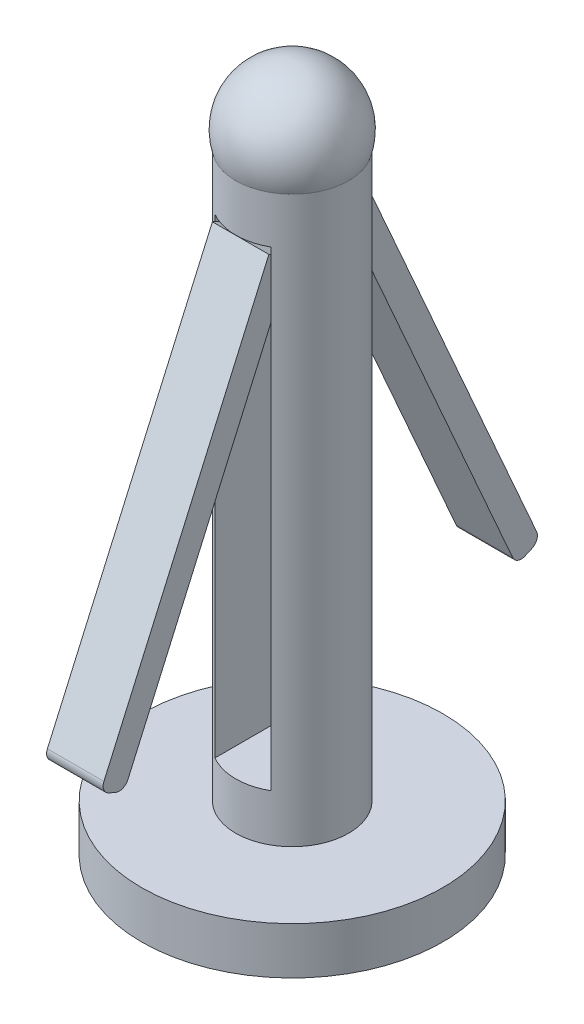
from build123d import *

# Parameters (mm, degrees)
SKETCH1_R               = 16
BOSS_EXTRUDE1_DEPTH     = 5
SKETCH2_R               = 6
BOSS_EXTRUDE2_DEPTH     = 60
DOME1_FACE_RADIUS       = 6
DOME1_HEIGHT            = 8
CUT_EXTRUDE1_DEPTH      = 6
CUT_EXTRUDE1_DEPTH_BACK = 6
SKETCH3_W               = 6
SKETCH3_H               = 50
BOSS_EXTRUDE6_DEPTH     = 6
FILLET2_R               = 1
FILLET4_R               = 1
FILLET2_OF_MIRROR2_R    = 1
FILLET4_OF_MIRROR2_R    = 1


with BuildPart() as part:
    # Sketch1 → Boss-Extrude1 (new body)
    with BuildSketch(Plane(origin=(0, 0, 0), x_dir=(1, 0, 0), z_dir=(0, 1, 0))):
        with Locations(Location((0, 0, 0), (0, 0, 270))):
            Circle(SKETCH1_R)
    extrude(amount=-BOSS_EXTRUDE1_DEPTH)

    # Sketch2 → Boss-Extrude2 (add)
    with BuildSketch(Plane(origin=(0, 0, 0), x_dir=(1, 0, 0), z_dir=(0, 1, 0))):
        with Locations(Location((0, 0, 0), (0, 0, 270))):
            Circle(SKETCH2_R)
    extrude(amount=BOSS_EXTRUDE2_DEPTH)

    # Dome1: a dome of height H over a round flat face of radius A is a cap of a sphere of radius (A * A + H * H) / (2 * H)
    dome1_r = (DOME1_FACE_RADIUS * DOME1_FACE_RADIUS + DOME1_HEIGHT * DOME1_HEIGHT) / (2 * DOME1_HEIGHT)
    dome1_base = Plane((0, 60, 0), z_dir=(0, 1, 0))
    with Locations(dome1_base.offset(DOME1_HEIGHT - dome1_r)):
        dome1_ball = Sphere(dome1_r, mode=Mode.PRIVATE)
    add(split(dome1_ball, bisect_by=dome1_base, keep=Keep.TOP, mode=Mode.PRIVATE))

    # Sketch3 → Cut-Extrude1 (cut, two sides: drawn at the far end of the back side and taken through both)
    with BuildSketch(Plane.XY.offset(-CUT_EXTRUDE1_DEPTH_BACK)):
        with Locations((-0.023759129, 30)):
            Rectangle(SKETCH3_W, SKETCH3_H)
    extrude(amount=CUT_EXTRUDE1_DEPTH + CUT_EXTRUDE1_DEPTH_BACK, mode=Mode.SUBTRACT)

    # Sketch4 → Boss-Extrude6 (add)
    with BuildSketch(Plane.ZY.offset(-2.976240871)):
        Polygon((5.454631491, 54.445098747), (23.375133838, 13.829372646), (20.834979102, 12.708603592), (2.914476754, 53.324329693), align=None)
    boss_extrude6 = extrude(amount=BOSS_EXTRUDE6_DEPTH)

    # Fillet2
    fillet2_edges = [part.edges().sort_by_distance(p)[0] for p in [
        (-0.023759129, 13.829372646, 23.375133838),
    ]]
    fillet(fillet2_edges, radius=FILLET2_R)

    # Fillet4
    fillet4_edges = [part.edges().sort_by_distance(p)[0] for p in [
        (-0.023759129, 12.708603592, 20.834979102),
    ]]
    fillet(fillet4_edges, radius=FILLET4_R)

    # Mirror2: Boss-Extrude6 across plane
    add(boss_extrude6.mirror(Plane.XY))

    # Fillet2 of Mirror2
    fillet2_of_mirror2_edges = [part.edges().sort_by_distance(p)[0] for p in [
        (-0.023759129, 13.829372646, -23.375133838),
    ]]
    fillet(fillet2_of_mirror2_edges, radius=FILLET2_OF_MIRROR2_R)

    # Fillet4 of Mirror2
    fillet4_of_mirror2_edges = [part.edges().sort_by_distance(p)[0] for p in [
        (-0.023759129, 12.708603592, -20.834979102),
    ]]
    fillet(fillet4_of_mirror2_edges, radius=FILLET4_OF_MIRROR2_R)


solid = part.part
